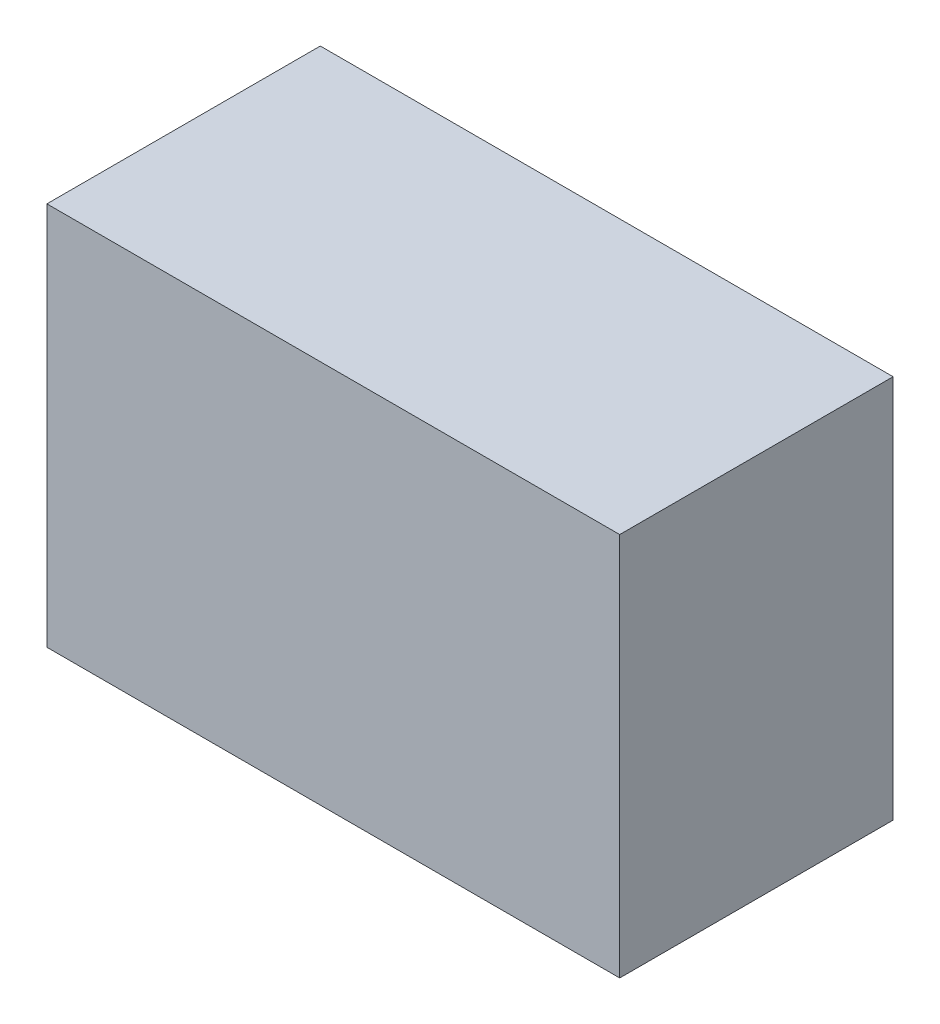
from build123d import *

# Parameters (mm, degrees)
ESQUISSE1_W        = 440
ESQUISSE1_H        = 210
BOSS_EXTRU_1_DEPTH = 295


with BuildPart() as part:
    # Esquisse1 → Boss.-Extru.1 (new body)
    with BuildSketch(Plane(origin=(0, 0, 0), x_dir=(1, 0, 0), z_dir=(0, 1, 0))):
        with Locations((0, -10)):
            Rectangle(ESQUISSE1_W, ESQUISSE1_H)
    extrude(amount=BOSS_EXTRU_1_DEPTH)


solid = part.part
